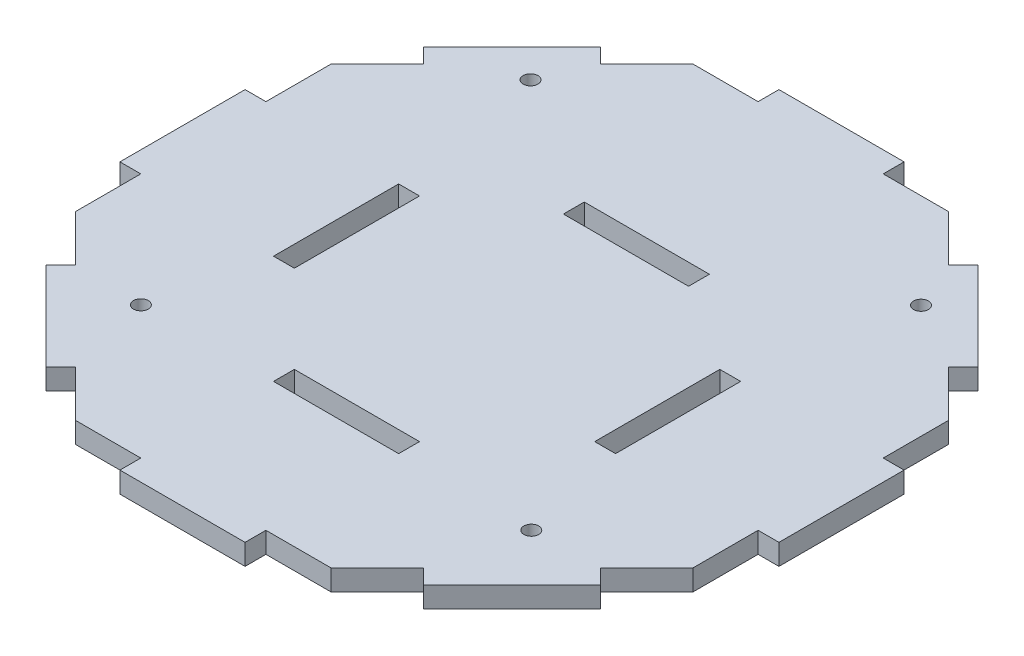
from build123d import *

# Parameters (mm, degrees)
BOSS_EXTRUDE1_DEPTH   = 3.175
F_2_CLEARANCE_HOLE1_D = 2.2606
SKETCH4_W             = 3.175
SKETCH4_H             = 19.05
SKETCH4_W_2           = 19.05
SKETCH4_H_2           = 3.175
CUT_EXTRUDE1_DEPTH    = 72.01498393


with BuildPart() as part:
    # Sketch1 → Boss-Extrude1 (new body)
    with BuildSketch(Plane(origin=(0, 0, 0), x_dir=(1, 0, 0), z_dir=(0, 1, 0))):
        Polygon((-19.463895296, 46.99), (-9.525027315, 46.99), (-9.525027315, 50.165), (9.524972685, 50.165), (9.524972685, 46.990031352), (19.463840666, 46.990031352), (26.491681613, 39.962190405), (28.736745643, 42.207254435), (42.207129825, 28.736870254), (39.962087963, 26.491828392), (46.98992891, 19.463987446), (46.98992891, 9.525119465), (50.16492891, 9.525119465), (50.16492891, -9.524880535), (46.989960262, -9.524880535), (46.989960262, -19.463748516), (39.962119315, -26.491589463), (42.207183345, -28.736653493), (28.736799164, -42.207037675), (26.491757302, -39.961995814), (19.463916356, -46.98983676), (9.525048375, -46.98983676), (9.525048375, -50.16483676), (-9.524951625, -50.16483676), (-9.524951625, -46.989868112), (-19.463819606, -46.989868112), (-26.491660553, -39.962027165), (-28.736724583, -42.207091196), (-42.207108765, -28.736707014), (-39.962066904, -26.491665153), (-46.98990785, -19.463824206), (-46.98990785, -9.524956225), (-50.16490785, -9.524956225), (-50.16490785, 9.525043775), (-46.989939202, 9.525043775), (-46.989939202, 19.463911756), (-39.962098255, 26.491752703), (-42.207162286, 28.736816733), (-28.736778104, 42.207200915), (-26.491736243, 39.962159053), align=None)
    extrude(amount=BOSS_EXTRUDE1_DEPTH)

    # #2 Clearance Hole1 (through all)
    with Locations(Plane(origin=(0, 3.175, 0), x_dir=(1, 0, 0), z_dir=(0, 1, 0))):
        with Locations((-29.718, -26.781346139), (-29.718, 32.541008543), (29.718, 32.541008543), (29.718, -26.781346139)):
            Hole(F_2_CLEARANCE_HOLE1_D / 2)

    # Sketch4 → Cut-Extrude1 (cut, through all)
    with BuildSketch(Plane(origin=(0, 3.175, 0), x_dir=(1, 0, 0), z_dir=(0, 1, 0))):
        with Locations((-24.4475, -0.746346139)):
            Rectangle(SKETCH4_W, SKETCH4_H)
        with Locations((24.4475, -0.746346139)):
            Rectangle(SKETCH4_W, SKETCH4_H)
        with Locations((0, 18.938653861)):
            Rectangle(SKETCH4_W_2, SKETCH4_H_2)
        with Locations((0, -25.193846139)):
            Rectangle(SKETCH4_W_2, SKETCH4_H_2)
    extrude(amount=-CUT_EXTRUDE1_DEPTH, mode=Mode.SUBTRACT)


solid = part.part
